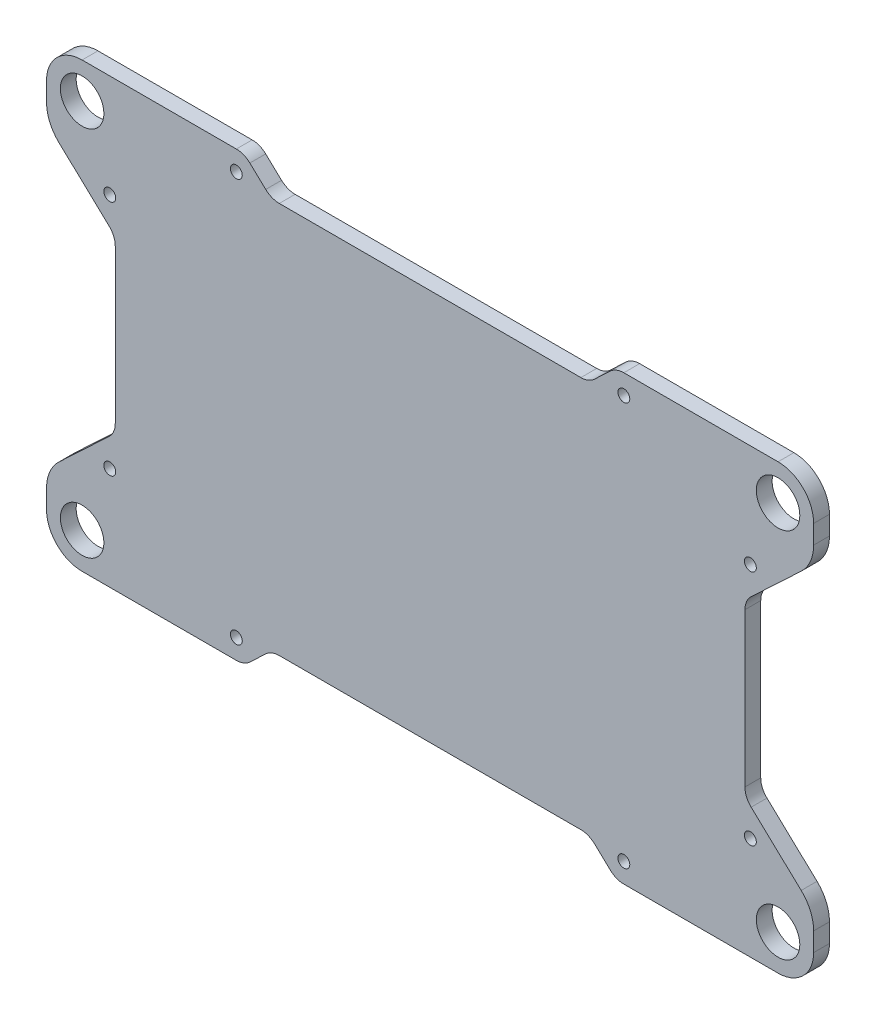
from build123d import *

# Parameters (mm, degrees)
SKETCH_1_R      = 1.5
SKETCH_1_R_2    = 5.5
EXTRUDE_1_DEPTH = 4


with BuildPart() as part:
    # Эскиз1 → Бобышка-Вытянуть1 (new body)
    with BuildSketch(Plane.XY):
        with BuildLine():
            Line((-1.474172714, 68.016601782), (-77.746457719, 68.016601782))
            ThreePointArc((-77.746457719, 68.016601782), (-79.588811782, 68.368405195), (-81.171907265, 69.374309179))
            Line((-81.171907265, 69.374309179), (-85.184865671, 73.148357023))
            ThreePointArc((-85.184865671, 73.148357023), (-86.767961154, 74.154261006), (-88.610315217, 74.506064419))
            Line((-88.610315217, 74.506064419), (-127.610315217, 74.506064419))
            ThreePointArc((-127.610315217, 74.506064419), (-133.974276247, 71.87002545), (-136.610315217, 65.506064419))
            Line((-136.610315217, 65.506064419), (-136.610315217, 60.749014849))
            ThreePointArc((-136.610315217, 60.749014849), (-135.789339972, 56.780954297), (-133.461214308, 53.464429642))
            Line((-133.461214308, 53.464429642), (-120.803854155, 41.560622533))
            ThreePointArc((-120.803854155, 41.560622533), (-119.639791323, 39.902360205), (-119.229303701, 37.918329929))
            Line((-119.229303701, 37.918329929), (-119.229303701, -0.906201091))
            ThreePointArc((-119.229303701, -0.906201091), (-119.639791323, -2.890231366), (-120.803854155, -4.548493694))
            Line((-120.803854155, -4.548493694), (-133.461214308, -16.452300803))
            ThreePointArc((-133.461214308, -16.452300803), (-135.789339972, -19.768825459), (-136.610315217, -23.73688601))
            Line((-136.610315217, -23.73688601), (-136.610315217, -28.493935581))
            ThreePointArc((-136.610315217, -28.493935581), (-133.974276247, -34.857896611), (-127.610315217, -37.493935581))
            Line((-127.610315217, -37.493935581), (-88.610315217, -37.493935581))
            ThreePointArc((-88.610315217, -37.493935581), (-86.767961154, -37.142132167), (-85.184865671, -36.136228184))
            Line((-85.184865671, -36.136228184), (-81.171907265, -32.36218034))
            ThreePointArc((-81.171907265, -32.36218034), (-79.588811782, -31.356276357), (-77.746457719, -31.004472943))
            Line((-77.746457719, -31.004472943), (-1.474172714, -31.004472943))
            ThreePointArc((-1.474172714, -31.004472943), (0.368181349, -31.356276357), (1.951276832, -32.36218034))
            Line((1.951276832, -32.36218034), (5.964235238, -36.136228184))
            ThreePointArc((5.964235238, -36.136228184), (7.547330721, -37.142132167), (9.389684783, -37.493935581))
            Line((9.389684783, -37.493935581), (48.389684783, -37.493935581))
            ThreePointArc((48.389684783, -37.493935581), (54.753645814, -34.857896611), (57.389684783, -28.493935581))
            Line((57.389684783, -28.493935581), (57.389684783, -23.73688601))
            ThreePointArc((57.389684783, -23.73688601), (56.568709539, -19.768825459), (54.240583875, -16.452300803))
            Line((54.240583875, -16.452300803), (41.583223722, -4.548493694))
            ThreePointArc((41.583223722, -4.548493694), (40.41916089, -2.890231366), (40.008673268, -0.906201091))
            Line((40.008673268, -0.906201091), (40.008673268, 37.918329929))
            ThreePointArc((40.008673268, 37.918329929), (40.41916089, 39.902360205), (41.583223722, 41.560622533))
            Line((41.583223722, 41.560622533), (54.240583875, 53.464429642))
            ThreePointArc((54.240583875, 53.464429642), (56.568709539, 56.780954297), (57.389684783, 60.749014849))
            Line((57.389684783, 60.749014849), (57.389684783, 65.506064419))
            ThreePointArc((57.389684783, 65.506064419), (54.753645814, 71.87002545), (48.389684783, 74.506064419))
            Line((48.389684783, 74.506064419), (9.389684783, 74.506064419))
            ThreePointArc((9.389684783, 74.506064419), (7.547330721, 74.154261006), (5.964235238, 73.148357023))
            Line((5.964235238, 73.148357023), (1.951276832, 69.374309179))
            ThreePointArc((1.951276832, 69.374309179), (0.368181349, 68.368405195), (-1.474172714, 68.016601782))
        make_face()
        with Locations((-88.610315217, 69.506064419)):
            Circle(SKETCH_1_R, mode=Mode.SUBTRACT)
        with Locations((-120.610315217, 48.506064419)):
            Circle(SKETCH_1_R, mode=Mode.SUBTRACT)
        with Locations((-127.610315217, 65.506064419)):
            Circle(SKETCH_1_R_2, mode=Mode.SUBTRACT)
        with Locations((-127.610315217, -28.493935581)):
            Circle(SKETCH_1_R_2, mode=Mode.SUBTRACT)
        with Locations((-120.610315217, -11.493935581)):
            Circle(SKETCH_1_R, mode=Mode.SUBTRACT)
        with Locations((-88.610315217, -32.493935581)):
            Circle(SKETCH_1_R, mode=Mode.SUBTRACT)
        with Locations((9.389684783, -32.493935581)):
            Circle(SKETCH_1_R, mode=Mode.SUBTRACT)
        with Locations((41.389684783, -11.493935581)):
            Circle(SKETCH_1_R, mode=Mode.SUBTRACT)
        with Locations((48.389684783, -28.493935581)):
            Circle(SKETCH_1_R_2, mode=Mode.SUBTRACT)
        with Locations((48.389684783, 65.506064419)):
            Circle(SKETCH_1_R_2, mode=Mode.SUBTRACT)
        with Locations((41.389684783, 48.506064419)):
            Circle(SKETCH_1_R, mode=Mode.SUBTRACT)
        with Locations((9.389684783, 69.506064419)):
            Circle(SKETCH_1_R, mode=Mode.SUBTRACT)
    extrude(amount=EXTRUDE_1_DEPTH)


solid = part.part
